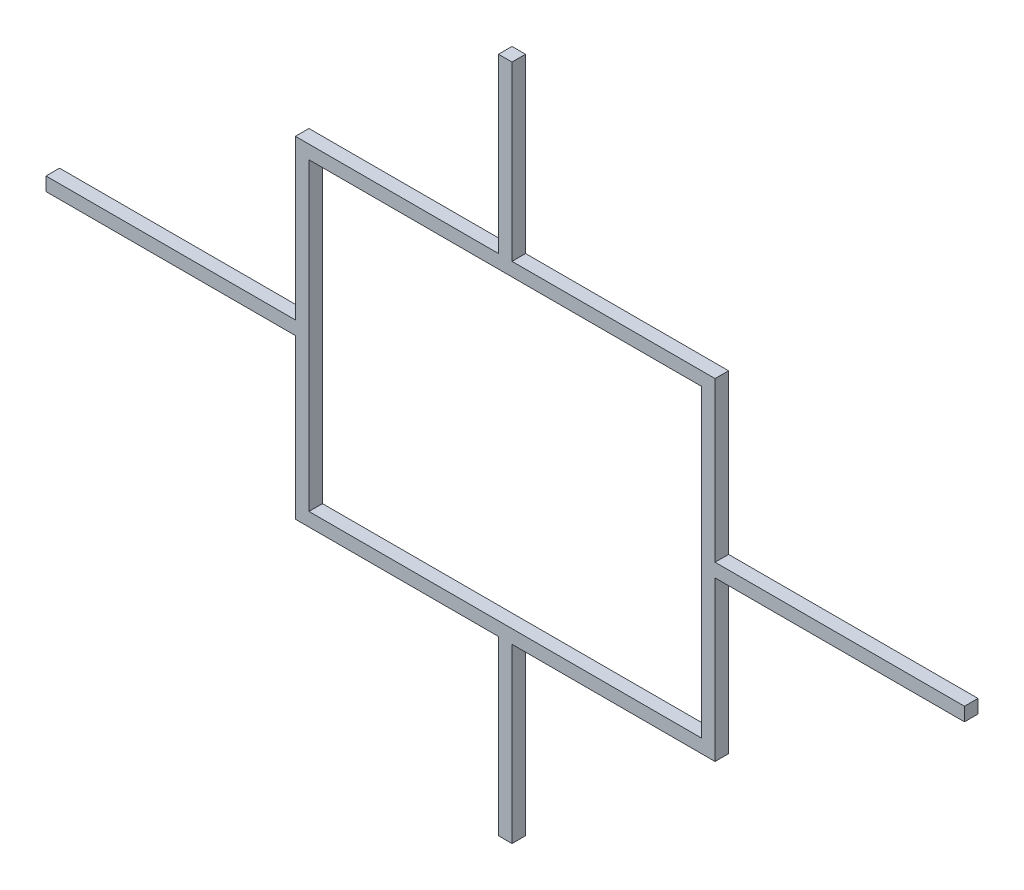
from build123d import *

# Parameters (mm, degrees)
SKETCH1_W           = 580
SKETCH1_H           = 450
BOSS_EXTRUDE1_DEPTH = 20


with BuildPart() as part:
    # Sketch1 → Boss-Extrude1 (new body)
    with BuildSketch(Plane.XY):
        Polygon((368.5, 745), (668.5, 745), (668.5, 1000), (688.5, 1000), (688.5, 745), (988.5, 745), (988.5, 510), (1357, 510), (1357, 490), (988.5, 490), (988.5, 255), (688.5, 255), (688.5, 0), (668.5, 0), (668.5, 255), (368.5, 255), (368.5, 490), (0, 490), (0, 510), (368.5, 510), align=None)
        with Locations((678.5, 500)):
            Rectangle(SKETCH1_W, SKETCH1_H, mode=Mode.SUBTRACT)
    extrude(amount=BOSS_EXTRUDE1_DEPTH)


solid = part.part
